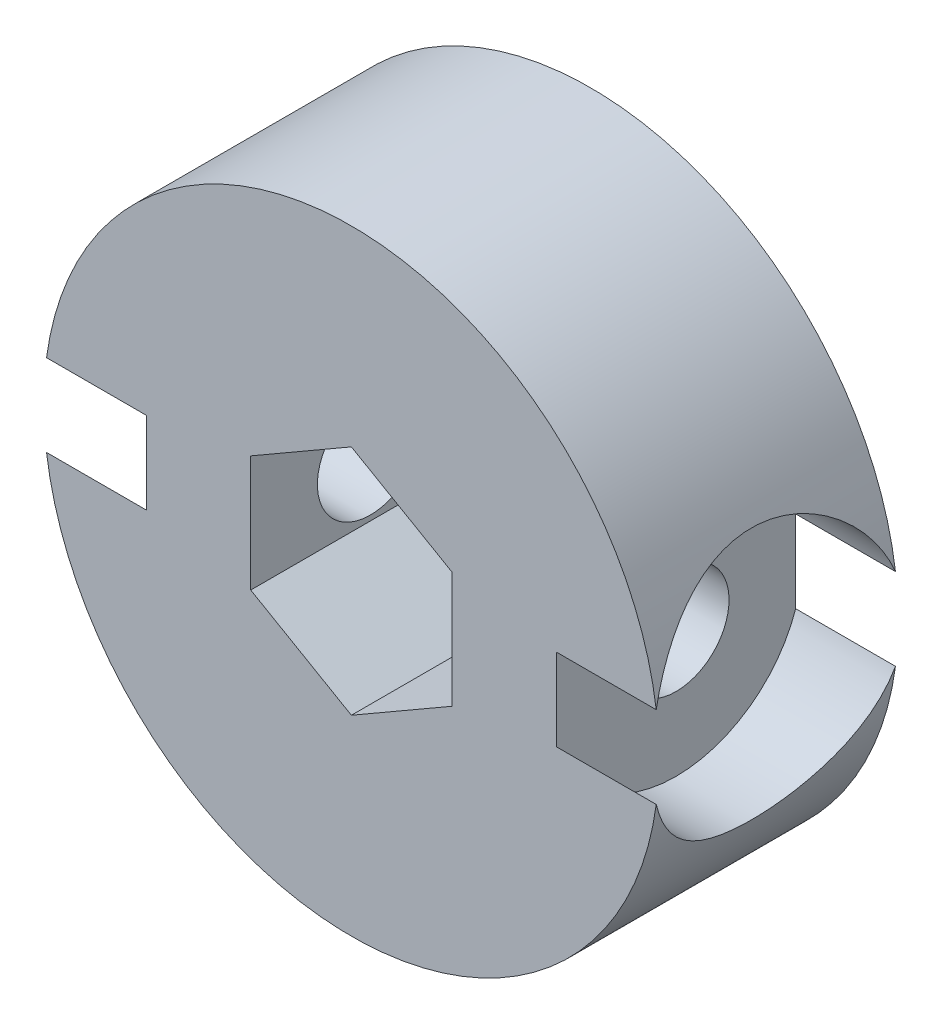
from build123d import *

# Parameters (mm, degrees)
SKETCH1_R               = 9
BOSS_EXTRUDE1_DEPTH     = 7
CUT_EXTRUDE1_DEPTH      = 9
CUT_EXTRUDE1_DEPTH_BACK = 9
SKETCH5_R               = 1.55
SKETCH6_R               = 3.7
CUT_EXTRUDE2_DEPTH      = 5.5
CUT_EXTRUDE3_START      = -5.5
SKETCH7_R               = 3.7
CUT_EXTRUDE3_DEPTH      = 5.5


with BuildPart() as part:
    # Sketch1 → Boss-Extrude1 (new body)
    with BuildSketch(Plane.XY):
        Circle(SKETCH1_R)
        Polygon((0, 3.4), (2.944486373, 1.7), (2.944486373, -1.7), (0, -3.4), (-2.944486373, -1.7), (-2.944486373, 1.7), align=None, mode=Mode.SUBTRACT)
    extrude(amount=BOSS_EXTRUDE1_DEPTH)

    # Sketch5 → Cut-Extrude1 (cut, two sides: drawn at the far end of the back side and taken through both)
    with BuildSketch(Plane.ZY.offset(-CUT_EXTRUDE1_DEPTH_BACK)):
        with Locations(Location((3.5, 0, 0), (0, 0, 180))):
            Circle(SKETCH5_R)
    extrude(amount=CUT_EXTRUDE1_DEPTH + CUT_EXTRUDE1_DEPTH_BACK, mode=Mode.SUBTRACT)

    # Sketch6 → Cut-Extrude2 (cut)
    with BuildSketch(Plane.ZY.offset(6)):
        with Locations((3.5, 0)):
            Circle(SKETCH6_R)
    extrude(amount=CUT_EXTRUDE2_DEPTH, mode=Mode.SUBTRACT)

    # Sketch7 → Cut-Extrude3 (cut)
    with BuildSketch(Plane.ZY.offset(-6).offset(CUT_EXTRUDE3_START)):
        with Locations((3.5, 0)):
            Circle(SKETCH7_R)
    extrude(amount=CUT_EXTRUDE3_DEPTH, mode=Mode.SUBTRACT)


solid = part.part
